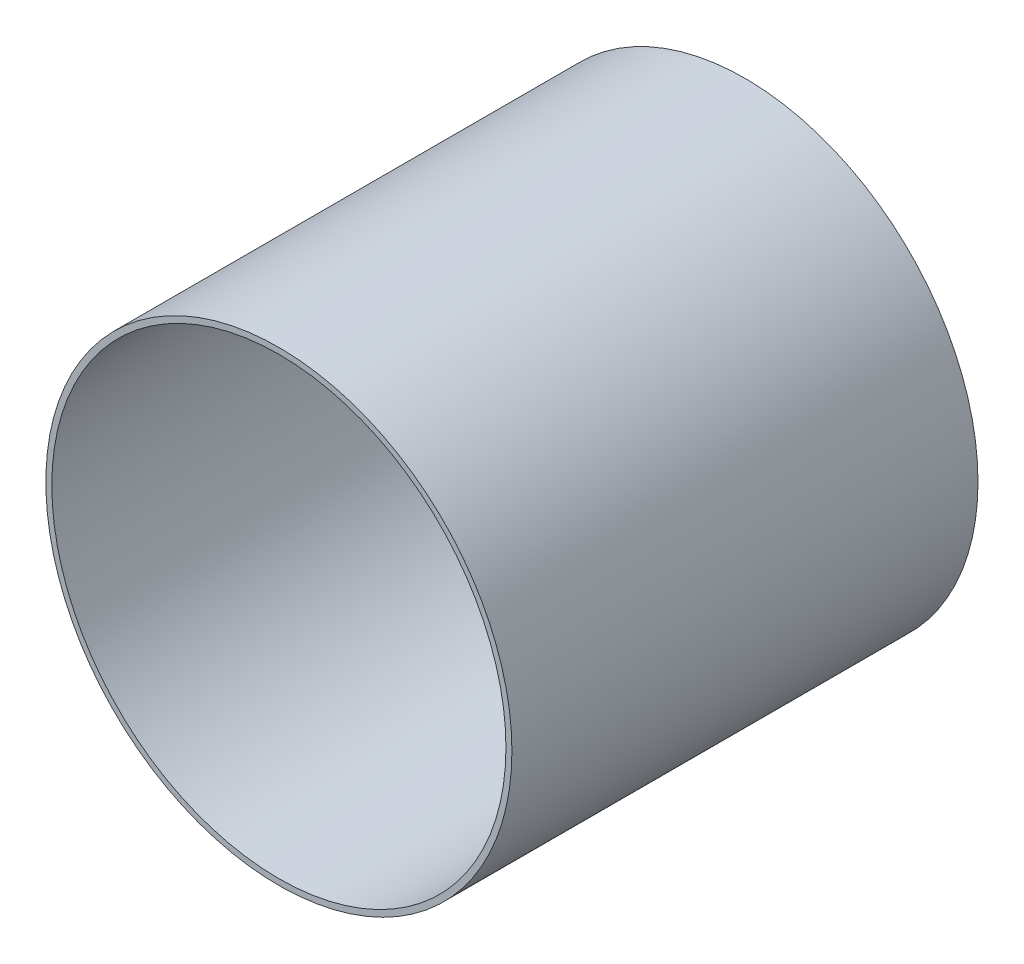
from build123d import *

# Parameters (mm, degrees)
SKETCH1_R           = 156
BOSS_EXTRUDE1_DEPTH = 312
SKETCH2_R           = 152
CUT_EXTRUDE1_DEPTH  = 312


with BuildPart() as part:
    # Sketch1 → Boss-Extrude1 (new body)
    with BuildSketch(Plane.XY):
        Circle(SKETCH1_R)
    extrude(amount=BOSS_EXTRUDE1_DEPTH)

    # Sketch2 → Cut-Extrude1 (cut)
    with BuildSketch(Plane.XY.offset(312)):
        Circle(SKETCH2_R)
    extrude(amount=-CUT_EXTRUDE1_DEPTH, mode=Mode.SUBTRACT)


solid = part.part
